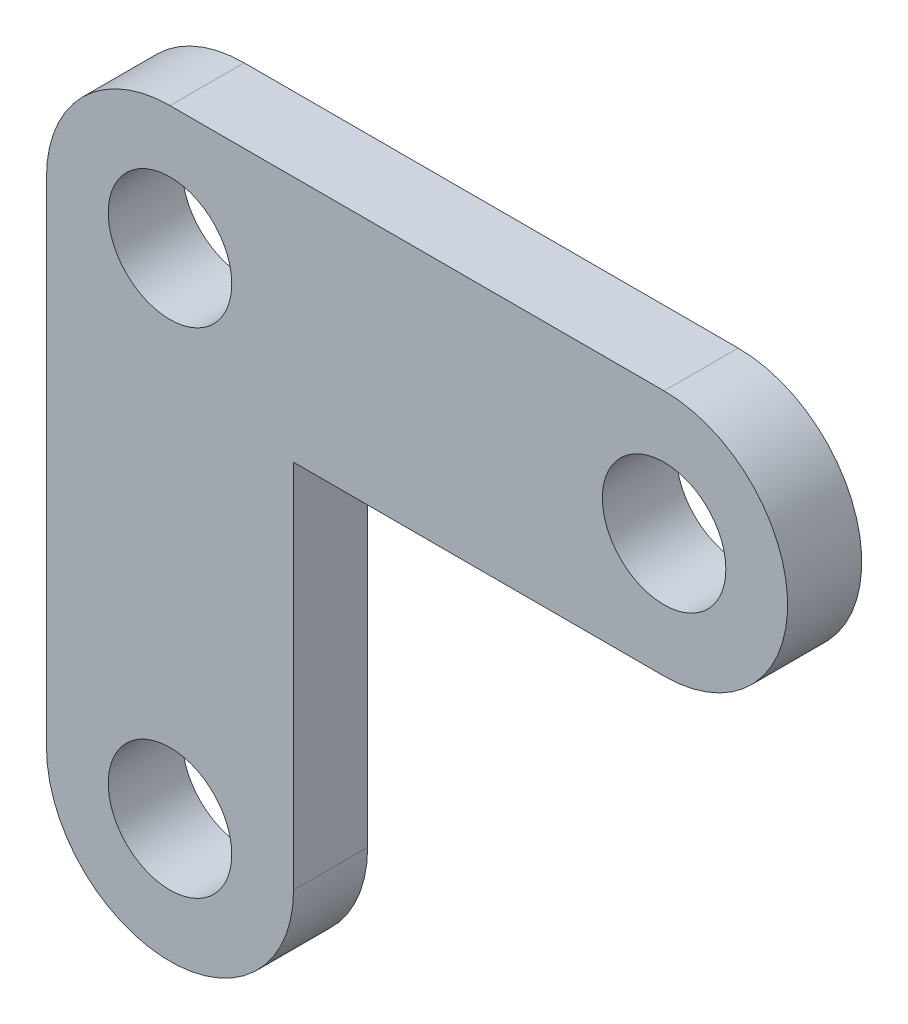
from build123d import *

# Parameters (mm, degrees)
SKETCH1_R           = 2.5
BOSS_EXTRUDE1_DEPTH = 3


with BuildPart() as part:
    # Sketch1 → Boss-Extrude1 (new body)
    # profile 1 of 4: a face of its own
    with BuildSketch(Plane.XY):
        with BuildLine():
            Line((29.001181793, 36.666122725), (9.001181793, 36.666122725))
            Line((9.001181793, 36.666122725), (9.001181793, 34.166122725))
            ThreePointArc((9.001181793, 34.166122725), (10.768948746, 33.433889678), (11.501181793, 31.666122725))
            Line((11.501181793, 31.666122725), (14.001181793, 31.666122725))
            Line((14.001181793, 31.666122725), (14.001181793, 26.666122725))
            Line((14.001181793, 26.666122725), (29.001181793, 26.666122725))
            ThreePointArc((29.001181793, 26.666122725), (34.001181793, 31.666122725), (29.001181793, 36.666122725))
        make_face()
        with Locations((29.001181793, 31.666122725)):
            Circle(SKETCH1_R, mode=Mode.SUBTRACT)
    # profile 2 of 4: a face of its own
    with BuildSketch(Plane.XY):
        with BuildLine():
            Line((4.001181793, 31.666122725), (4.001181793, 11.666122725))
            ThreePointArc((4.001181793, 11.666122725), (9.001181793, 6.666122725), (14.001181793, 11.666122725))
            Line((14.001181793, 11.666122725), (14.001181793, 26.666122725))
            Line((14.001181793, 26.666122725), (9.001181793, 26.666122725))
            Line((9.001181793, 26.666122725), (9.001181793, 29.166122725))
            ThreePointArc((9.001181793, 29.166122725), (7.23341484, 29.898355772), (6.501181793, 31.666122725))
            Line((6.501181793, 31.666122725), (4.001181793, 31.666122725))
        make_face()
        with Locations((9.001181793, 11.666122725)):
            Circle(SKETCH1_R, mode=Mode.SUBTRACT)
    # profile 3 of 4: a face of its own
    with BuildSketch(Plane.XY):
        with BuildLine():
            Line((9.001181793, 26.666122725), (14.001181793, 26.666122725))
            Line((14.001181793, 26.666122725), (14.001181793, 31.666122725))
            Line((14.001181793, 31.666122725), (11.501181793, 31.666122725))
            ThreePointArc((11.501181793, 31.666122725), (10.768948746, 29.898355772), (9.001181793, 29.166122725))
            Line((9.001181793, 29.166122725), (9.001181793, 26.666122725))
        make_face()
    # profile 4 of 4: a face of its own
    with BuildSketch(Plane.XY):
        with BuildLine():
            ThreePointArc((9.001181793, 36.666122725), (5.465647887, 35.201656631), (4.001181793, 31.666122725))
            Line((4.001181793, 31.666122725), (6.501181793, 31.666122725))
            ThreePointArc((6.501181793, 31.666122725), (7.23341484, 33.433889678), (9.001181793, 34.166122725))
            Line((9.001181793, 34.166122725), (9.001181793, 36.666122725))
        make_face()
    extrude(amount=BOSS_EXTRUDE1_DEPTH)


solid = part.part
